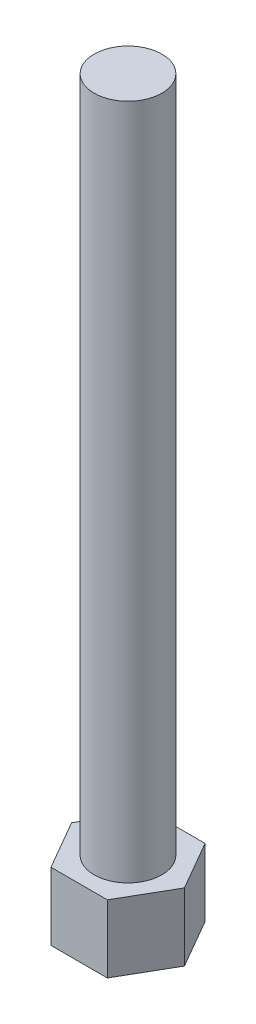
from build123d import *

# Parameters (mm, degrees)
SKETCH1_R           = 1.5
BOSS_EXTRUDE1_DEPTH = 30
BOSS_EXTRUDE2_DEPTH = 3


with BuildPart() as part:
    # Sketch1 → Boss-Extrude1 (new body)
    with BuildSketch(Plane(origin=(0, 0, 0), x_dir=(1, 0, 0), z_dir=(0, 1, 0))):
        with Locations(Location((0, 0, 0), (0, 0, 270))):
            Circle(SKETCH1_R)
    extrude(amount=BOSS_EXTRUDE1_DEPTH)

    # Sketch2 → Boss-Extrude2 (add)
    with BuildSketch(Plane.XZ):
        Polygon((1.25, -2.165063509), (2.5, 0), (1.25, 2.165063509), (-1.25, 2.165063509), (-2.5, 0), (-1.25, -2.165063509), align=None)
    extrude(amount=BOSS_EXTRUDE2_DEPTH)


solid = part.part
